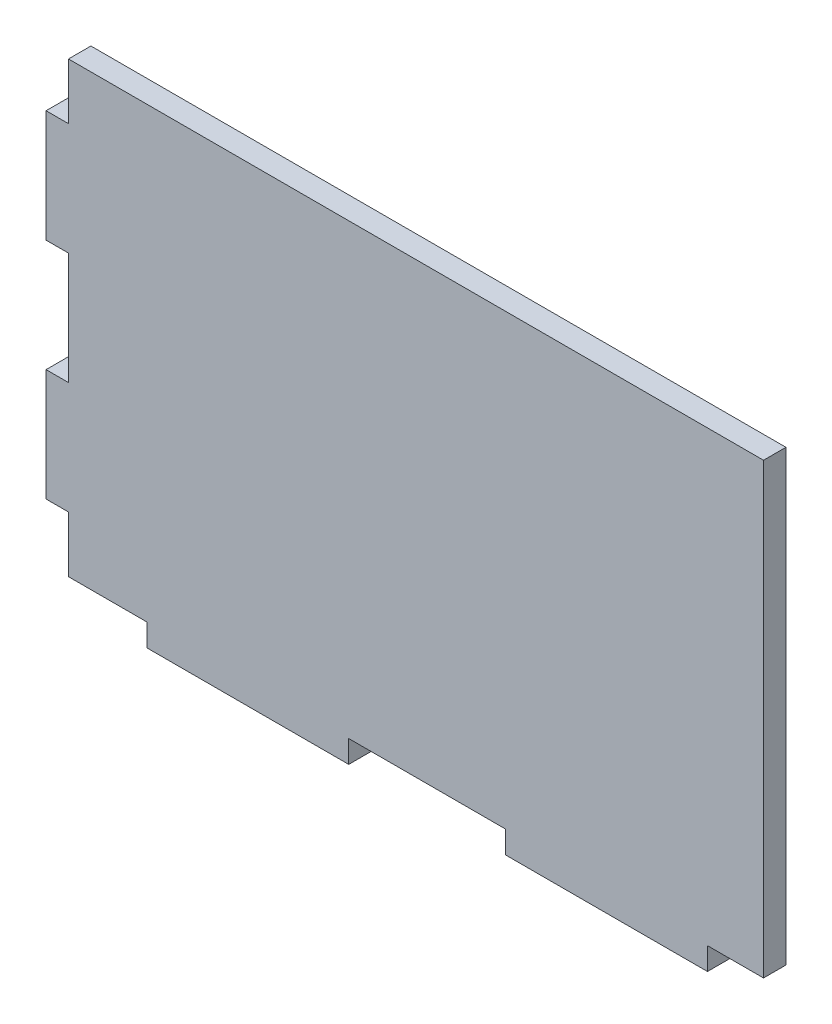
from build123d import *

# Parameters (mm, degrees)
CROQUIS1_W              = 5
CROQUIS1_H              = 25
SALIENTE_EXTRUIR1_DEPTH = 5
CROQUIS3_W              = 5
CROQUIS3_H              = 25
SALIENTE_EXTRUIR2_DEPTH = 5


with BuildPart() as part:
    # Croquis1 → Saliente-Extruir1 (new body)
    with BuildSketch(Plane.XY):
        Polygon((0, 12.5), (0, 0), (17.5, 0), (17.5, -5), (62.5, -5), (62.5, 0), (97.5, 0), (97.5, -5), (142.5, -5), (142.5, 0), (155, 0), (155, 100), (0, 100), (0, 87.5), (5, 87.5), (5, 62.5), (0, 62.5), (0, 37.5), (5, 37.5), (5, 12.5), align=None)
        with Locations((2.5, 25)):
            Rectangle(CROQUIS1_W, CROQUIS1_H)
        with Locations((2.5, 75)):
            Rectangle(CROQUIS1_W, CROQUIS1_H)
    extrude(amount=SALIENTE_EXTRUIR1_DEPTH)

    # Croquis3 → Saliente-Extruir2 (add)
    with BuildSketch(Plane.XY.offset(5)):
        with Locations((-2.5, 25)):
            Rectangle(CROQUIS3_W, CROQUIS3_H)
        with Locations((-2.5, 75)):
            Rectangle(CROQUIS3_W, CROQUIS3_H)
    extrude(amount=-SALIENTE_EXTRUIR2_DEPTH)


solid = part.part
